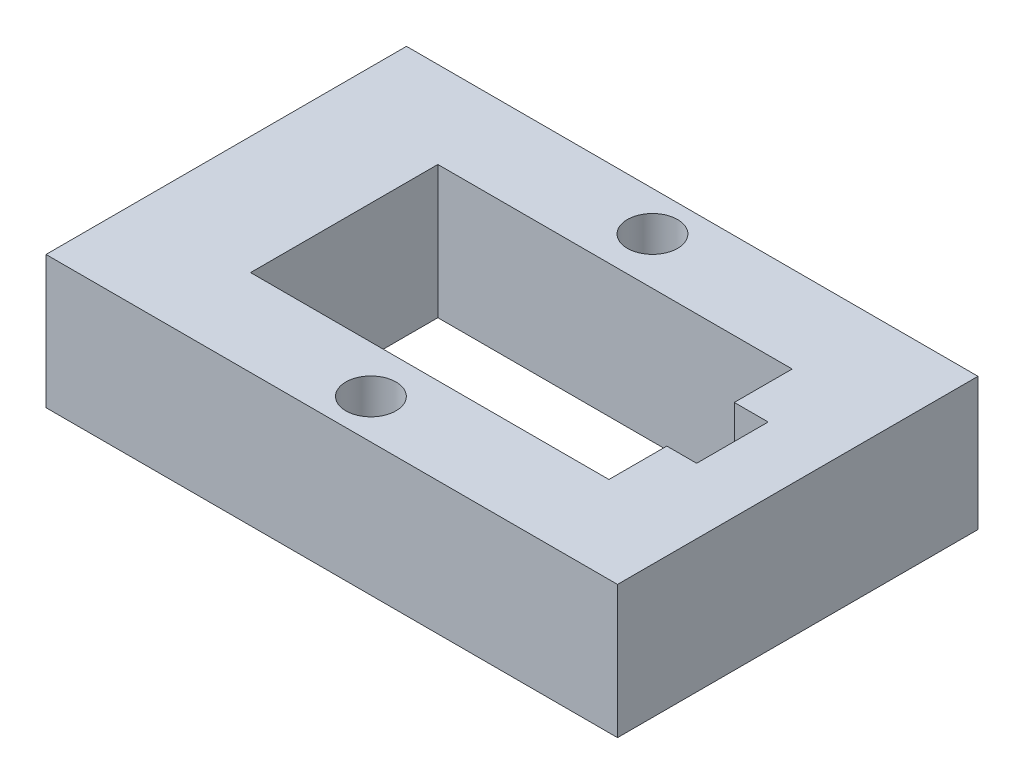
from build123d import *

# Parameters (mm, degrees)
SKETCH2_W           = 38.75194
SKETCH2_H           = 24.44303
SKETCH2_R           = 1.7
BOSS_EXTRUDE1_DEPTH = 4.5


with BuildPart() as part:
    # Sketch2 → Boss-Extrude1 (new, symmetric)
    with BuildSketch(Plane(origin=(0, 0, 0), x_dir=(1, 0, 0), z_dir=(0, 1, 0))):
        with Locations((-1.253031638, 1.410566346)):
            Rectangle(SKETCH2_W, SKETCH2_H)
        with Locations(Location((-1.272682118, 10.954361346, 0), (0, 0, 270))):
            Circle(SKETCH2_R, mode=Mode.SUBTRACT)
        with Locations(Location((-1.277061638, -8.130948654, 0), (0, 0, 270))):
            Circle(SKETCH2_R, mode=Mode.SUBTRACT)
        Polygon((-12.629001638, 7.759051346), (11.395558827, 7.759051346), (11.395558827, 3.833946346), (13.692948362, 3.833946346), (13.692948362, -1.015843654), (11.670998362, -1.015843654), (11.670998362, -4.940948654), (-12.629001638, -4.940948654), align=None, mode=Mode.SUBTRACT)
    extrude(amount=BOSS_EXTRUDE1_DEPTH, both=True)


solid = part.part
